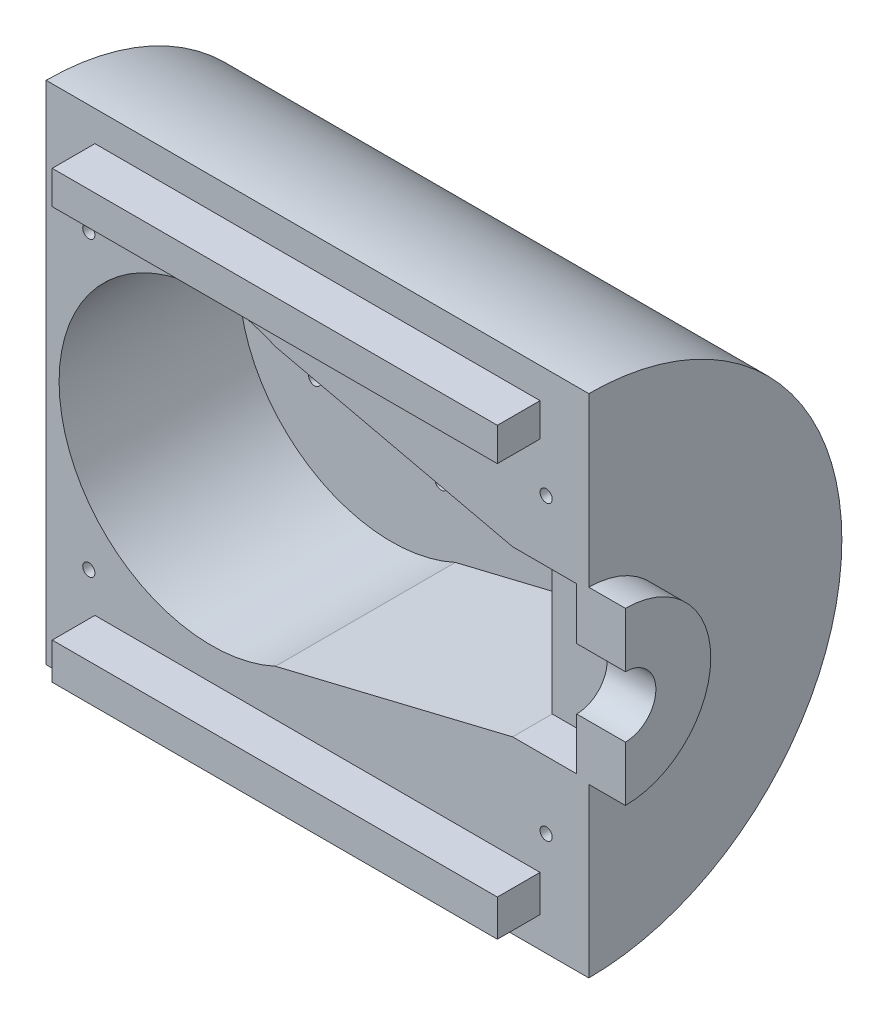
from build123d import *

# Parameters (mm, degrees)
BOSS_EXTRUDE2_DEPTH = 87
CUT_EXTRUDE1_DEPTH  = 29.5
SKETCH3_R           = 1
CUT_EXTRUDE2_DEPTH  = 130.771336418
SKETCH4_R           = 1.7
CUT_EXTRUDE3_DEPTH  = 10
BOSS_EXTRUDE3_START = 2
BOSS_EXTRUDE3_DEPTH = 2
BOSS_EXTRUDE4_START = 6
BOSS_EXTRUDE4_DEPTH = 6
SKETCH7_W           = 73
SKETCH7_H           = 5.446782016
SKETCH7_H_2         = 6
CUT_EXTRUDE4_DEPTH  = 7
SKETCH8_R           = 1
CUT_EXTRUDE5_DEPTH  = 136.438914135
SKETCH9_R           = 2.5
CUT_EXTRUDE6_DEPTH  = 32
SKETCH11_W          = 10.498637593
SKETCH11_H          = 26.999999931
BOSS_EXTRUDE6_DEPTH = 23
SKETCH12_W          = 73
SKETCH12_H          = 6
SKETCH12_H_2        = 5.446782016
BOSS_EXTRUDE7_DEPTH = 14


with BuildPart() as part:
    # Sketch1 → Boss-Extrude2 (new body)
    with BuildSketch(Plane(origin=(89.94373008, 0, 0), x_dir=(0, 0, -1), z_dir=(1, 0, 0))):
        with BuildLine():
            Line((-104.016306216, 83.836001664), (-104.016306216, 0.836001664))
            ThreePointArc((-104.016306216, 0.836001664), (-62.516306216, 42.336001664), (-104.016306216, 83.836001664))
        make_face()
    extrude(amount=-BOSS_EXTRUDE2_DEPTH)

    # Sketch2 → Cut-Extrude1 (cut)
    with BuildSketch(Plane.XY.offset(104.016306216)):
        with BuildLine():
            Line((89.94373008, 55.836001595), (79.445092487, 55.836001664))
            Line((79.445092487, 55.836001664), (40.551337791, 64.805487997))
            ThreePointArc((40.551337791, 64.805487997), (5.067466824, 42.109927869), (40.551337791, 19.414367741))
            Line((40.551337791, 19.414367741), (79.445092487, 28.836001664))
            Line((79.445092487, 28.836001664), (89.94373008, 28.836001664))
            Line((89.94373008, 28.836001664), (89.94373008, 55.836001595))
        make_face()
    extrude(amount=-CUT_EXTRUDE1_DEPTH, mode=Mode.SUBTRACT)

    # Sketch3 → Cut-Extrude2 (cut, through all)
    with BuildSketch(Plane(origin=(0, 0, 62.516306216), x_dir=(-1, 0, 0), z_dir=(0, 0, -1))):
        with Locations(Location((-42.657418818, 50.264258545, 0), (0, 0, 90))):
            Circle(SKETCH3_R)
        with Locations(Location((-21.913136148, 54.699879864, 0), (0, 0, 90))):
            Circle(SKETCH3_R)
        with Locations(Location((-38.2217975, 29.519975875, 0), (0, 0, 90))):
            Circle(SKETCH3_R)
        with Locations(Location((-17.477514829, 33.955597193, 0), (0, 0, 90))):
            Circle(SKETCH3_R)
    extrude(amount=-CUT_EXTRUDE2_DEPTH, mode=Mode.SUBTRACT)

    # Sketch4 → Cut-Extrude3 (cut)
    with BuildSketch(Plane(origin=(0, 0, 62.516306216), x_dir=(-1, 0, 0), z_dir=(0, 0, -1))):
        with Locations(Location((-42.657418818, 50.264258545, 0), (0, 0, 90))):
            Circle(SKETCH4_R)
        with Locations(Location((-21.913136148, 54.699879864, 0), (0, 0, 90))):
            Circle(SKETCH4_R)
        with Locations(Location((-38.2217975, 29.519975875, 0), (0, 0, 90))):
            Circle(SKETCH4_R)
        with Locations(Location((-17.477514829, 33.955597193, 0), (0, 0, 90))):
            Circle(SKETCH4_R)
    extrude(amount=-CUT_EXTRUDE3_DEPTH, mode=Mode.SUBTRACT)

    # Sketch5 → Boss-Extrude3 (add)
    with BuildSketch(Plane(origin=(89.94373008, 0, 0), x_dir=(0, 0, -1), z_dir=(1, 0, 0)).offset(BOSS_EXTRUDE3_START)):
        with BuildLine():
            Line((-104.016306216, 55.836001595), (-104.016306216, 47.336001664))
            ThreePointArc((-104.016306216, 47.336001664), (-99.016306216, 42.336001664), (-104.016306216, 37.336001664))
            Line((-104.016306216, 37.336001664), (-104.016306216, 28.836001664))
            Line((-104.016306216, 28.836001664), (-104.016306216, 0.836001664))
            ThreePointArc((-104.016306216, 0.836001664), (-62.516306216, 42.336001664), (-104.016306216, 83.836001664))
            Line((-104.016306216, 83.836001664), (-104.016306216, 55.836001595))
        make_face()
    extrude(amount=-BOSS_EXTRUDE3_DEPTH)

    # Sketch6 → Boss-Extrude4 (add)
    with BuildSketch(Plane(origin=(91.94373008, 0, 0), x_dir=(0, 0, -1), z_dir=(1, 0, 0)).offset(BOSS_EXTRUDE4_START)):
        with BuildLine():
            Line((-104.016306216, 56.336001664), (-104.016306216, 47.336001664))
            ThreePointArc((-104.016306216, 47.336001664), (-99.016306216, 42.336001664), (-104.016306216, 37.336001664))
            Line((-104.016306216, 37.336001664), (-104.016306216, 28.336001664))
            ThreePointArc((-104.016306216, 28.336001664), (-90.016306216, 42.336001664), (-104.016306216, 56.336001664))
        make_face()
    extrude(amount=-BOSS_EXTRUDE4_DEPTH)

    # Sketch7 → Cut-Extrude4 (cut)
    with BuildSketch(Plane.XY.offset(104.016306216)):
        with Locations((47.44373008, 76.112610656)):
            Rectangle(SKETCH7_W, SKETCH7_H)
        with Locations((47.44373008, 8.836001664)):
            Rectangle(SKETCH7_W, SKETCH7_H_2)
    extrude(amount=-CUT_EXTRUDE4_DEPTH, mode=Mode.SUBTRACT)

    # Sketch8 → Cut-Extrude5 (cut, through all)
    with BuildSketch(Plane(origin=(0, 0, 62.516306216), x_dir=(-1, 0, 0), z_dir=(0, 0, -1))):
        with Locations(Location((-84.94373008, 65.836001664, 0), (0, 0, 90))):
            Circle(SKETCH8_R)
        with Locations(Location((-84.94373008, 17.836001664, 0), (0, 0, 90))):
            Circle(SKETCH8_R)
        with Locations(Location((-9.94373008, 65.836001664, 0), (0, 0, 90))):
            Circle(SKETCH8_R)
        with Locations(Location((-9.94373008, 17.836001664, 0), (0, 0, 90))):
            Circle(SKETCH8_R)
    extrude(amount=-CUT_EXTRUDE5_DEPTH, mode=Mode.SUBTRACT)

    # Sketch9 → Cut-Extrude6 (cut)
    with BuildSketch(Plane(origin=(0, 0, 62.516306216), x_dir=(-1, 0, 0), z_dir=(0, 0, -1))):
        with Locations(Location((-84.94373008, 65.836001664, 0), (0, 0, 90))):
            Circle(SKETCH9_R)
        with Locations(Location((-84.94373008, 17.836001664, 0), (0, 0, 90))):
            Circle(SKETCH9_R)
        with Locations(Location((-9.94373008, 65.836001664, 0), (0, 0, 90))):
            Circle(SKETCH9_R)
        with Locations(Location((-9.94373008, 17.836001664, 0), (0, 0, 90))):
            Circle(SKETCH9_R)
    extrude(amount=-CUT_EXTRUDE6_DEPTH, mode=Mode.SUBTRACT)

    # Sketch11 → Boss-Extrude6 (add)
    with BuildSketch(Plane.XY.offset(74.516306216)):
        with Locations((84.694411284, 42.33600163)):
            Rectangle(SKETCH11_W, SKETCH11_H)
    extrude(amount=BOSS_EXTRUDE6_DEPTH)

    # Sketch12 → Boss-Extrude7 (add)
    with BuildSketch(Plane(origin=(0, 0, 97.016306216), x_dir=(-1, 0, 0), z_dir=(0, 0, -1))):
        with Locations((-47.44373008, 8.836001664)):
            Rectangle(SKETCH12_W, SKETCH12_H)
        with Locations((-47.44373008, 76.112610656)):
            Rectangle(SKETCH12_W, SKETCH12_H_2)
    extrude(amount=-BOSS_EXTRUDE7_DEPTH)


solid = part.part
